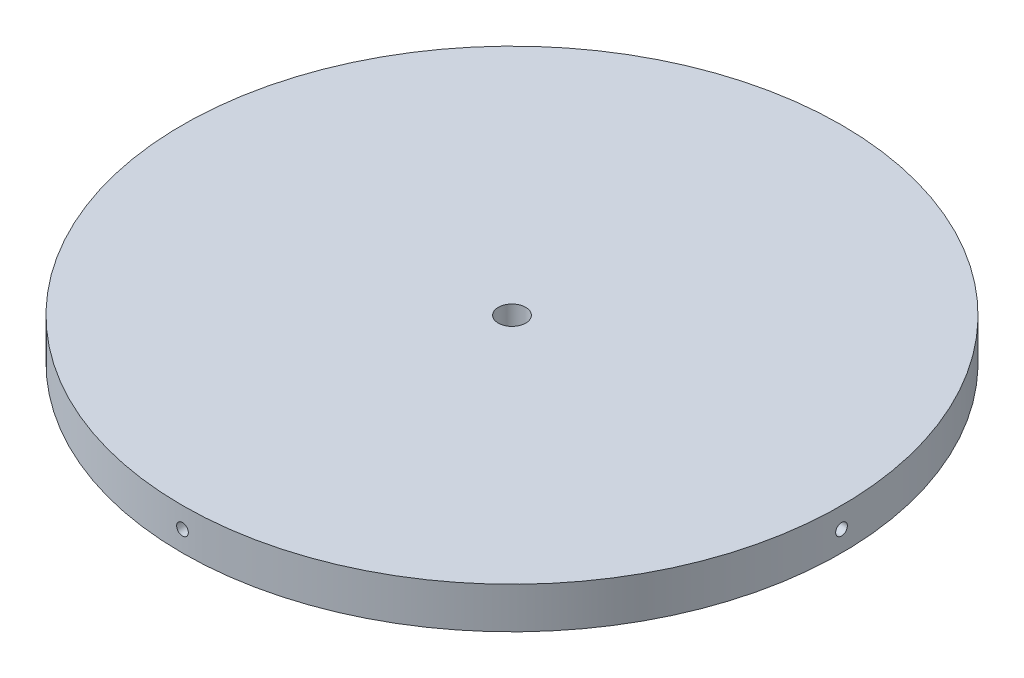
from build123d import *

# Parameters (mm, degrees)
SKETCH1_R           = 76.1746
BOSS_EXTRUDE1_DEPTH = 9.525
SKETCH2_R           = 3.175
CUT_EXTRUDE1_DEPTH  = 109.147422509
CIRPATTERN1_COUNT   = 4


with BuildPart() as part:
    # Sketch1 → Boss-Extrude1 (new body)
    with BuildSketch(Plane(origin=(0, 0, 0), x_dir=(1, 0, 0), z_dir=(0, 1, 0))):
        with Locations(Location((0, 0, 0), (0, 0, 90))):
            Circle(SKETCH1_R)
    extrude(amount=BOSS_EXTRUDE1_DEPTH)

    # Sketch2 → Cut-Extrude1 (cut, through all)
    with BuildSketch(Plane(origin=(0, 9.525, 0), x_dir=(1, 0, 0), z_dir=(0, 1, 0))):
        with Locations(Location((0, 0, 0), (0, 0, 270))):
            Circle(SKETCH2_R)
    extrude(amount=-CUT_EXTRUDE1_DEPTH, mode=Mode.SUBTRACT)

    # Sketch5 → Tap Drill for #6-32 Tap1 (revolve, cut)
    with BuildSketch(Plane(origin=(0, 4.7625, 76.1746), x_dir=(0, -1, 0), z_dir=(1, 0, 0))):
        Polygon((0, 0), (0, 10.46469403), (1.35255, 9.652), (1.35255, 0), align=None)
    tap_drill_for_6_32_tap1 = revolve(axis=Axis((0, 4.7625, 82.5246), (0, 0, -1)), mode=Mode.SUBTRACT)

    # CirPattern1: Tap Drill for #6-32 Tap1 ×4 about axis
    cirpattern1_axis = Axis((0, 9.525, 0), (0, 1, 0))
    for i in range(1, CIRPATTERN1_COUNT):
        add(tap_drill_for_6_32_tap1.rotate(cirpattern1_axis, i * 360 / CIRPATTERN1_COUNT), mode=Mode.SUBTRACT)


solid = part.part
